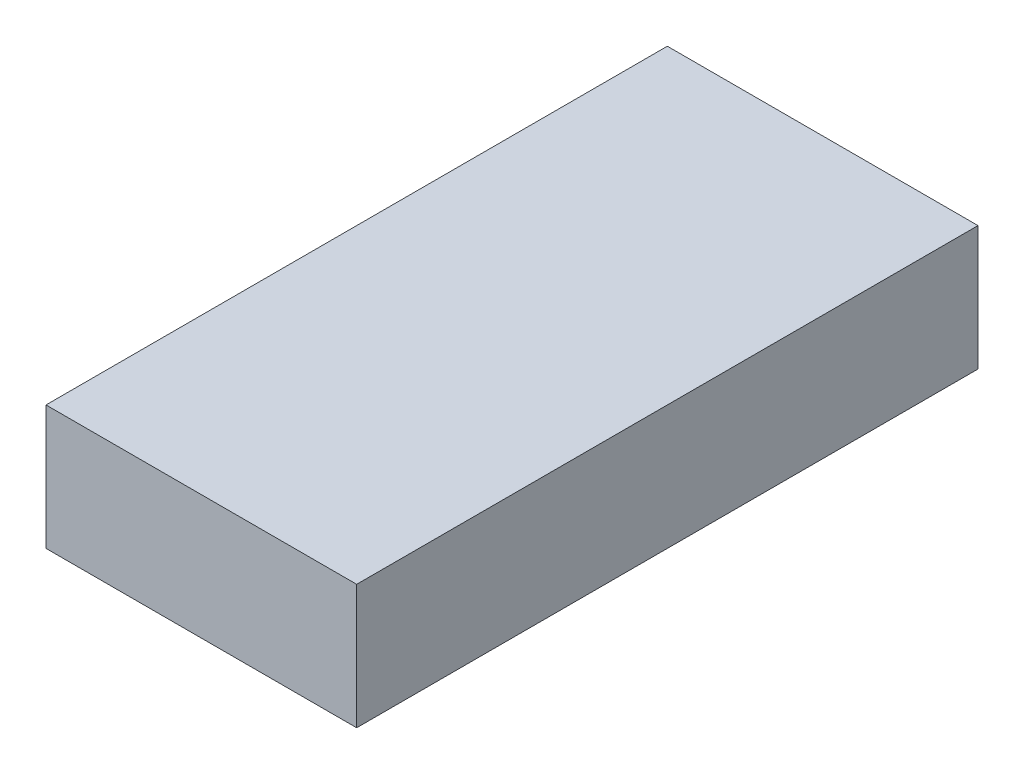
from build123d import *

# Parameters (mm, degrees)
SKICA1_W                = 50
SKICA1_H                = 20
P_IDAT_VYSUNUT_M1_DEPTH = 100


with BuildPart() as part:
    # Skica1 → Přidat vysunutím1 (new body)
    with BuildSketch(Plane.XY):
        with Locations((-25, 10)):
            Rectangle(SKICA1_W, SKICA1_H)
    extrude(amount=P_IDAT_VYSUNUT_M1_DEPTH)


solid = part.part
